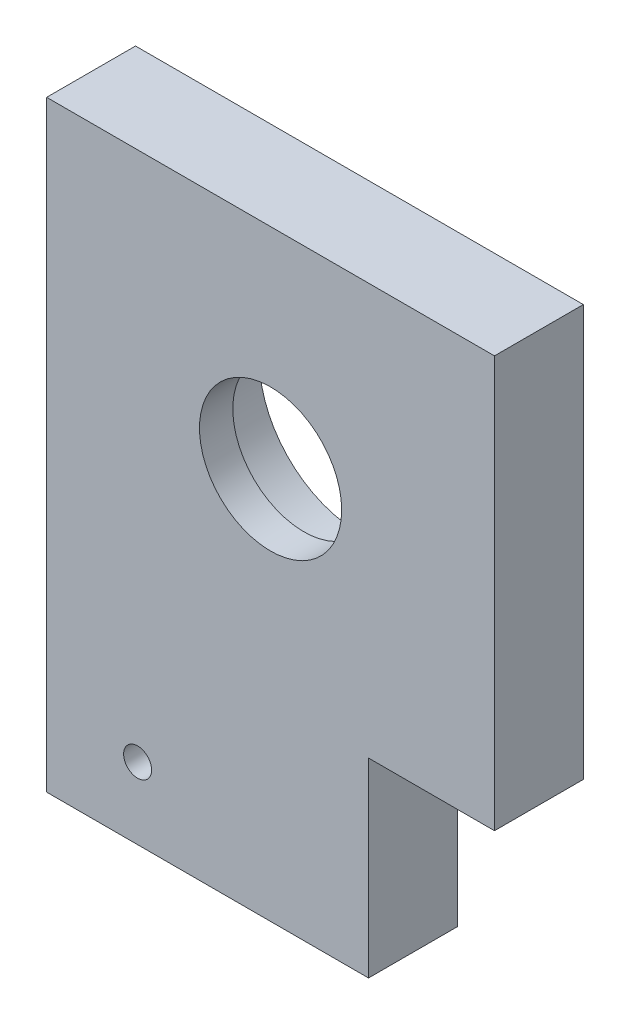
from build123d import *

# Parameters (mm, degrees)
SKETCH1_R           = 10.16
SKETCH1_R_2         = 2
BOSS_EXTRUDE1_DEPTH = 12.7
SKETCH2_R           = 14.2875
CUT_EXTRUDE1_DEPTH  = 7.9375


with BuildPart() as part:
    # Sketch1 → Boss-Extrude1 (new body)
    with BuildSketch(Plane.XY):
        Polygon((14, -56), (-32, -56), (-32, 0), (-32, 30), (32, 30), (32, -28.77498914), (14, -28.77498914), align=None)
        Circle(SKETCH1_R, mode=Mode.SUBTRACT)
        with Locations((-19, -45.77498914)):
            Circle(SKETCH1_R_2, mode=Mode.SUBTRACT)
    extrude(amount=BOSS_EXTRUDE1_DEPTH)

    # Sketch2 → Cut-Extrude1 (cut)
    with BuildSketch(Plane.XY):
        Circle(SKETCH2_R)
    extrude(amount=CUT_EXTRUDE1_DEPTH, mode=Mode.SUBTRACT)


solid = part.part
